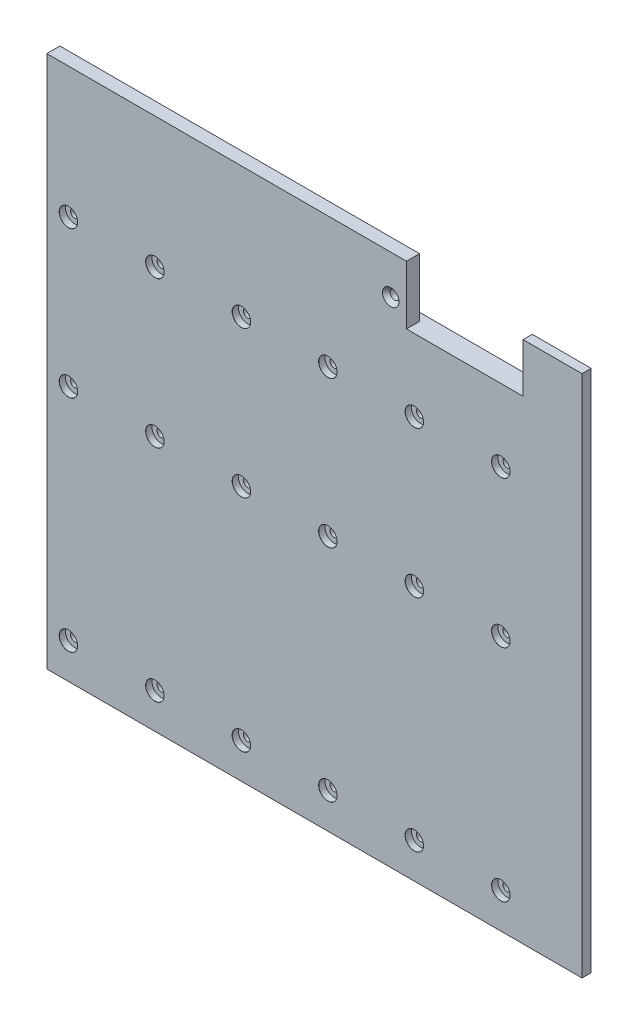
from build123d import *

# Parameters (mm, degrees)
ESQUISSE1_W                                    = 408.5
ESQUISSE1_H                                    = 181
BOSS_EXTRU_1_DEPTH                             = 8
CHAMBRAGE_POUR_VIS_T_TE_RONDE_BOMB_2_COUNT     = 2
CHAMBRAGE_POUR_VIS_T_TE_RONDE_BOMB_2_PITCH     = 56
CHAMBRAGE_POUR_VIS_T_TE_RONDE_BOMB_3_COUNT     = 2
CHAMBRAGE_POUR_VIS_T_TE_RONDE_BOMB_3_PITCH     = 140
R_P_TITION_LIN_AIRE1_COUNT                     = 11
R_P_TITION_LIN_AIRE1_PITCH                     = 33
ESQUISSE4_W                                    = 22.5
ESQUISSE4_H                                    = 4.5
ENL_V_MAT_EXTRU_1_DEPTH                        = 181
ESQUISSE5_W                                    = 22.5
ESQUISSE5_H                                    = 18.725
BOSS_EXTRU_2_DEPTH                             = 3.5
ESQUISSE7_W                                    = 274.5
ESQUISSE7_H                                    = 22.375
BOSS_EXTRU_3_DEPTH                             = 5
FRAISAGE_POUR_VIS_T_TE_FRAIS_E_M31_D           = 3.4
FRAISAGE_POUR_VIS_T_TE_FRAIS_E_M31_CSINK_D     = 6.3
FRAISAGE_POUR_VIS_T_TE_FRAIS_E_M31_CSINK_ANGLE = 90
ESQUISSE10_W                                   = 204.25
ESQUISSE10_H                                   = 203.375
ENL_V_MAT_EXTRU_2_DEPTH                        = 10


with BuildPart() as part:
    # Esquisse1 → Boss.-Extru.1 (new body)
    with BuildSketch(Plane.XY):
        Rectangle(ESQUISSE1_W, ESQUISSE1_H)
    extrude(amount=BOSS_EXTRU_1_DEPTH)

    # Esquisse3 → Chambrage pour vis à tête ronde bombée M31 (revolve, cut)
    with BuildSketch(Plane(origin=(-156.75, 63, 8), x_dir=(0, -1, 0), z_dir=(1, 0, 0))):
        Polygon((0, 0), (0, 8), (1.6, 8), (1.6, 2.4), (3.5, 2.4), (3.5, 0.025), (3.525, 0), align=None)
    chambrage_pour_vis_t_te_ronde_bomb_e_m = revolve(axis=Axis((-156.75, 63, 14.35), (0, 0, -1)), mode=Mode.SUBTRACT)

    # Chambrage pour vis _ t_te ronde bomb 2: Chambrage pour vis à tête ronde bombée M31 ×2
    with Locations(*[(0, -i * CHAMBRAGE_POUR_VIS_T_TE_RONDE_BOMB_2_PITCH, 0) for i in range(1, CHAMBRAGE_POUR_VIS_T_TE_RONDE_BOMB_2_COUNT)]):
        add(chambrage_pour_vis_t_te_ronde_bomb_e_m, mode=Mode.SUBTRACT)

    # Chambrage pour vis _ t_te ronde bomb 3: Chambrage pour vis à tête ronde bombée M31 ×2
    with Locations(*[(0, -i * CHAMBRAGE_POUR_VIS_T_TE_RONDE_BOMB_3_PITCH, 0) for i in range(1, CHAMBRAGE_POUR_VIS_T_TE_RONDE_BOMB_3_COUNT)]):
        add(chambrage_pour_vis_t_te_ronde_bomb_e_m, mode=Mode.SUBTRACT)

    # Répétition linéaire1: Chambrage pour vis à tête ronde bombée M31 ×11
    with Locations(*[(i * R_P_TITION_LIN_AIRE1_PITCH, 0, 0) for i in range(1, R_P_TITION_LIN_AIRE1_COUNT)]):
        add(chambrage_pour_vis_t_te_ronde_bomb_e_m, mode=Mode.SUBTRACT)

    # Répétition linéaire1 copy 1 sketch → Répétition linéaire1 copy 1 (revolve, cut)
    with BuildSketch(Plane(origin=(-123.75, 7, 8), x_dir=(0, -1, 0), z_dir=(1, 0, 0))):
        Polygon((0, 0), (0, 8), (1.6, 8), (1.6, 2.4), (3.5, 2.4), (3.5, 0.025), (3.525, 0), align=None)
    revolve(axis=Axis((-123.75, 7, 14.35), (0, 0, -1)), mode=Mode.SUBTRACT)

    # Répétition linéaire1 copy 2 sketch → Répétition linéaire1 copy 2 (revolve, cut)
    with BuildSketch(Plane(origin=(-90.75, 7, 8), x_dir=(0, -1, 0), z_dir=(1, 0, 0))):
        Polygon((0, 0), (0, 8), (1.6, 8), (1.6, 2.4), (3.5, 2.4), (3.5, 0.025), (3.525, 0), align=None)
    revolve(axis=Axis((-90.75, 7, 14.35), (0, 0, -1)), mode=Mode.SUBTRACT)

    # Répétition linéaire1 copy 3 sketch → Répétition linéaire1 copy 3 (revolve, cut)
    with BuildSketch(Plane(origin=(-57.75, 7, 8), x_dir=(0, -1, 0), z_dir=(1, 0, 0))):
        Polygon((0, 0), (0, 8), (1.6, 8), (1.6, 2.4), (3.5, 2.4), (3.5, 0.025), (3.525, 0), align=None)
    revolve(axis=Axis((-57.75, 7, 14.35), (0, 0, -1)), mode=Mode.SUBTRACT)

    # Répétition linéaire1 copy 4 sketch → Répétition linéaire1 copy 4 (revolve, cut)
    with BuildSketch(Plane(origin=(-24.75, 7, 8), x_dir=(0, -1, 0), z_dir=(1, 0, 0))):
        Polygon((0, 0), (0, 8), (1.6, 8), (1.6, 2.4), (3.5, 2.4), (3.5, 0.025), (3.525, 0), align=None)
    revolve(axis=Axis((-24.75, 7, 14.35), (0, 0, -1)), mode=Mode.SUBTRACT)

    # Répétition linéaire1 copy 5 sketch → Répétition linéaire1 copy 5 (revolve, cut)
    with BuildSketch(Plane(origin=(8.25, 7, 8), x_dir=(0, -1, 0), z_dir=(1, 0, 0))):
        Polygon((0, 0), (0, 8), (1.6, 8), (1.6, 2.4), (3.5, 2.4), (3.5, 0.025), (3.525, 0), align=None)
    revolve(axis=Axis((8.25, 7, 14.35), (0, 0, -1)), mode=Mode.SUBTRACT)

    # Répétition linéaire1 copy 6 sketch → Répétition linéaire1 copy 6 (revolve, cut)
    with BuildSketch(Plane(origin=(41.25, 7, 8), x_dir=(0, -1, 0), z_dir=(1, 0, 0))):
        Polygon((0, 0), (0, 8), (1.6, 8), (1.6, 2.4), (3.5, 2.4), (3.5, 0.025), (3.525, 0), align=None)
    revolve(axis=Axis((41.25, 7, 14.35), (0, 0, -1)), mode=Mode.SUBTRACT)

    # Répétition linéaire1 copy 7 sketch → Répétition linéaire1 copy 7 (revolve, cut)
    with BuildSketch(Plane(origin=(74.25, 7, 8), x_dir=(0, -1, 0), z_dir=(1, 0, 0))):
        Polygon((0, 0), (0, 8), (1.6, 8), (1.6, 2.4), (3.5, 2.4), (3.5, 0.025), (3.525, 0), align=None)
    revolve(axis=Axis((74.25, 7, 14.35), (0, 0, -1)), mode=Mode.SUBTRACT)

    # Répétition linéaire1 copy 8 sketch → Répétition linéaire1 copy 8 (revolve, cut)
    with BuildSketch(Plane(origin=(107.25, 7, 8), x_dir=(0, -1, 0), z_dir=(1, 0, 0))):
        Polygon((0, 0), (0, 8), (1.6, 8), (1.6, 2.4), (3.5, 2.4), (3.5, 0.025), (3.525, 0), align=None)
    revolve(axis=Axis((107.25, 7, 14.35), (0, 0, -1)), mode=Mode.SUBTRACT)

    # Répétition linéaire1 copy 9 sketch → Répétition linéaire1 copy 9 (revolve, cut)
    with BuildSketch(Plane(origin=(140.25, 7, 8), x_dir=(0, -1, 0), z_dir=(1, 0, 0))):
        Polygon((0, 0), (0, 8), (1.6, 8), (1.6, 2.4), (3.5, 2.4), (3.5, 0.025), (3.525, 0), align=None)
    revolve(axis=Axis((140.25, 7, 14.35), (0, 0, -1)), mode=Mode.SUBTRACT)

    # Répétition linéaire1 copy 10 sketch → Répétition linéaire1 copy 10 (revolve, cut)
    with BuildSketch(Plane(origin=(173.25, 7, 8), x_dir=(0, -1, 0), z_dir=(1, 0, 0))):
        Polygon((0, 0), (0, 8), (1.6, 8), (1.6, 2.4), (3.5, 2.4), (3.5, 0.025), (3.525, 0), align=None)
    revolve(axis=Axis((173.25, 7, 14.35), (0, 0, -1)), mode=Mode.SUBTRACT)

    # Répétition linéaire1 copy 11 sketch → Répétition linéaire1 copy 11 (revolve, cut)
    with BuildSketch(Plane(origin=(-123.75, -77, 8), x_dir=(0, -1, 0), z_dir=(1, 0, 0))):
        Polygon((0, 0), (0, 8), (1.6, 8), (1.6, 2.4), (3.5, 2.4), (3.5, 0.025), (3.525, 0), align=None)
    revolve(axis=Axis((-123.75, -77, 14.35), (0, 0, -1)), mode=Mode.SUBTRACT)

    # Répétition linéaire1 copy 12 sketch → Répétition linéaire1 copy 12 (revolve, cut)
    with BuildSketch(Plane(origin=(-90.75, -77, 8), x_dir=(0, -1, 0), z_dir=(1, 0, 0))):
        Polygon((0, 0), (0, 8), (1.6, 8), (1.6, 2.4), (3.5, 2.4), (3.5, 0.025), (3.525, 0), align=None)
    revolve(axis=Axis((-90.75, -77, 14.35), (0, 0, -1)), mode=Mode.SUBTRACT)

    # Répétition linéaire1 copy 13 sketch → Répétition linéaire1 copy 13 (revolve, cut)
    with BuildSketch(Plane(origin=(-57.75, -77, 8), x_dir=(0, -1, 0), z_dir=(1, 0, 0))):
        Polygon((0, 0), (0, 8), (1.6, 8), (1.6, 2.4), (3.5, 2.4), (3.5, 0.025), (3.525, 0), align=None)
    revolve(axis=Axis((-57.75, -77, 14.35), (0, 0, -1)), mode=Mode.SUBTRACT)

    # Répétition linéaire1 copy 14 sketch → Répétition linéaire1 copy 14 (revolve, cut)
    with BuildSketch(Plane(origin=(-24.75, -77, 8), x_dir=(0, -1, 0), z_dir=(1, 0, 0))):
        Polygon((0, 0), (0, 8), (1.6, 8), (1.6, 2.4), (3.5, 2.4), (3.5, 0.025), (3.525, 0), align=None)
    revolve(axis=Axis((-24.75, -77, 14.35), (0, 0, -1)), mode=Mode.SUBTRACT)

    # Répétition linéaire1 copy 15 sketch → Répétition linéaire1 copy 15 (revolve, cut)
    with BuildSketch(Plane(origin=(8.25, -77, 8), x_dir=(0, -1, 0), z_dir=(1, 0, 0))):
        Polygon((0, 0), (0, 8), (1.6, 8), (1.6, 2.4), (3.5, 2.4), (3.5, 0.025), (3.525, 0), align=None)
    revolve(axis=Axis((8.25, -77, 14.35), (0, 0, -1)), mode=Mode.SUBTRACT)

    # Répétition linéaire1 copy 16 sketch → Répétition linéaire1 copy 16 (revolve, cut)
    with BuildSketch(Plane(origin=(41.25, -77, 8), x_dir=(0, -1, 0), z_dir=(1, 0, 0))):
        Polygon((0, 0), (0, 8), (1.6, 8), (1.6, 2.4), (3.5, 2.4), (3.5, 0.025), (3.525, 0), align=None)
    revolve(axis=Axis((41.25, -77, 14.35), (0, 0, -1)), mode=Mode.SUBTRACT)

    # Répétition linéaire1 copy 17 sketch → Répétition linéaire1 copy 17 (revolve, cut)
    with BuildSketch(Plane(origin=(74.25, -77, 8), x_dir=(0, -1, 0), z_dir=(1, 0, 0))):
        Polygon((0, 0), (0, 8), (1.6, 8), (1.6, 2.4), (3.5, 2.4), (3.5, 0.025), (3.525, 0), align=None)
    revolve(axis=Axis((74.25, -77, 14.35), (0, 0, -1)), mode=Mode.SUBTRACT)

    # Répétition linéaire1 copy 18 sketch → Répétition linéaire1 copy 18 (revolve, cut)
    with BuildSketch(Plane(origin=(107.25, -77, 8), x_dir=(0, -1, 0), z_dir=(1, 0, 0))):
        Polygon((0, 0), (0, 8), (1.6, 8), (1.6, 2.4), (3.5, 2.4), (3.5, 0.025), (3.525, 0), align=None)
    revolve(axis=Axis((107.25, -77, 14.35), (0, 0, -1)), mode=Mode.SUBTRACT)

    # Répétition linéaire1 copy 19 sketch → Répétition linéaire1 copy 19 (revolve, cut)
    with BuildSketch(Plane(origin=(140.25, -77, 8), x_dir=(0, -1, 0), z_dir=(1, 0, 0))):
        Polygon((0, 0), (0, 8), (1.6, 8), (1.6, 2.4), (3.5, 2.4), (3.5, 0.025), (3.525, 0), align=None)
    revolve(axis=Axis((140.25, -77, 14.35), (0, 0, -1)), mode=Mode.SUBTRACT)

    # Répétition linéaire1 copy 20 sketch → Répétition linéaire1 copy 20 (revolve, cut)
    with BuildSketch(Plane(origin=(173.25, -77, 8), x_dir=(0, -1, 0), z_dir=(1, 0, 0))):
        Polygon((0, 0), (0, 8), (1.6, 8), (1.6, 2.4), (3.5, 2.4), (3.5, 0.025), (3.525, 0), align=None)
    revolve(axis=Axis((173.25, -77, 14.35), (0, 0, -1)), mode=Mode.SUBTRACT)

    # Esquisse4 → Enlèv. mat.-Extru.1 (cut)
    with BuildSketch(Plane(origin=(0, 90.5, 0), x_dir=(1, 0, 0), z_dir=(0, 1, 0))):
        with Locations((-193, -2.25)):
            Rectangle(ESQUISSE4_W, ESQUISSE4_H)
        with Locations((193, -2.25)):
            Rectangle(ESQUISSE4_W, ESQUISSE4_H)
    extrude(amount=-ENL_V_MAT_EXTRU_1_DEPTH, mode=Mode.SUBTRACT)

    # Esquisse5 → Boss.-Extru.2 (add)
    with BuildSketch(Plane.XY.offset(8)):
        with Locations((-193, 99.8625)):
            Rectangle(ESQUISSE5_W, ESQUISSE5_H)
    boss_extru_2 = extrude(amount=-BOSS_EXTRU_2_DEPTH)

    # Symétrie1: Boss.-Extru.2 across plane
    add(boss_extru_2.mirror(Plane(origin=(0, 0, 0), x_dir=(0, 0, 1), z_dir=(1, 0, 0))))

    # Esquisse7 → Boss.-Extru.3 (add)
    with BuildSketch(Plane.XY.offset(8)):
        with Locations((0, 101.6875)):
            Rectangle(ESQUISSE7_W, ESQUISSE7_H)
    extrude(amount=-BOSS_EXTRU_3_DEPTH)

    # Fraisage pour vis à tête fraisée M31 (through all)
    with Locations(Plane.XY.offset(8)):
        with Locations((-131.25, 98), (131.25, 98)):
            CounterSinkHole(FRAISAGE_POUR_VIS_T_TE_FRAIS_E_M31_D / 2, FRAISAGE_POUR_VIS_T_TE_FRAIS_E_M31_CSINK_D / 2, counter_sink_angle=FRAISAGE_POUR_VIS_T_TE_FRAIS_E_M31_CSINK_ANGLE)

    # Esquisse10 → Enlèv. mat.-Extru.2 (cut)
    with BuildSketch(Plane(origin=(0, 0, 0), x_dir=(-1, 0, 0), z_dir=(0, 0, -1))):
        with Locations((102.125, 11.1875)):
            Rectangle(ESQUISSE10_W, ESQUISSE10_H)
    extrude(amount=-ENL_V_MAT_EXTRU_2_DEPTH, mode=Mode.SUBTRACT)


solid = part.part
